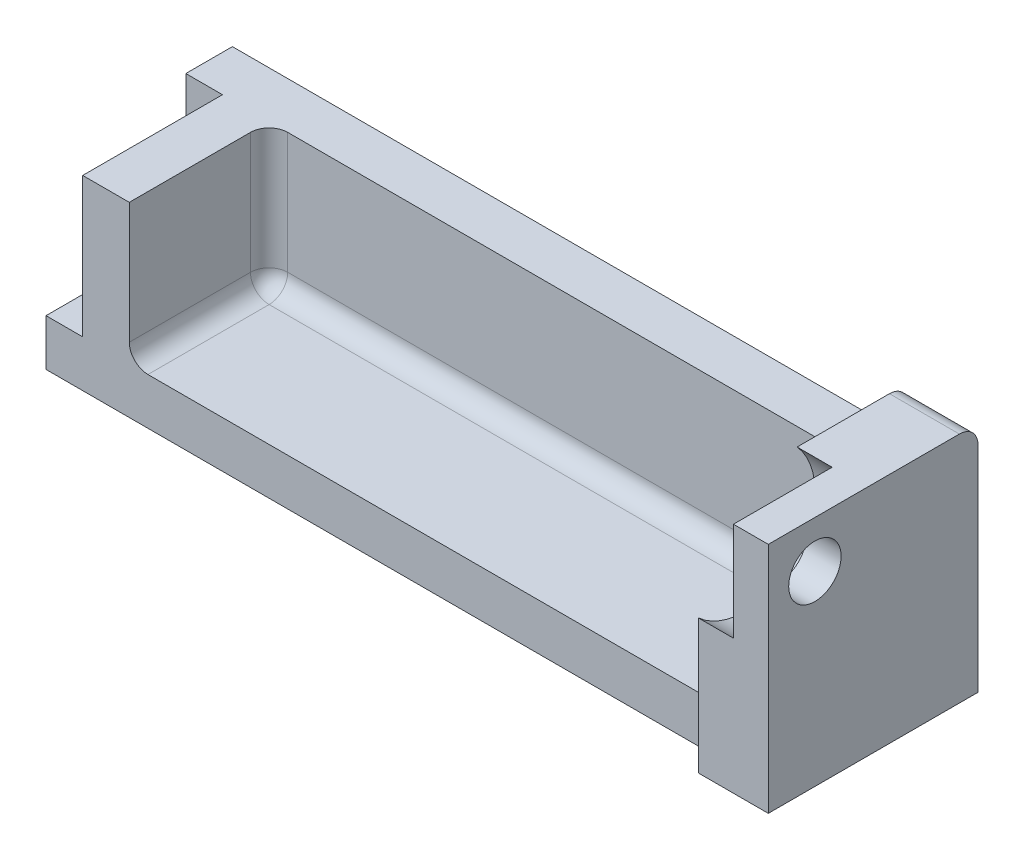
from build123d import *

# Parameters (mm, degrees)
SKETCH1_W                                = 101.6
SKETCH1_H                                = 25.4
BOSS_EXTRUDE1_DEPTH                      = 25.4
SKETCH2_W                                = 80.725
SKETCH2_H                                = 19.05
CUT_EXTRUDE1_DEPTH                       = 19.05
SKETCH3_W                                = 19.05
SKETCH3_H                                = 19.05
CUT_EXTRUDE2_DEPTH                       = 5
SKETCH4_W                                = 9.525
SKETCH4_H                                = 25.4
BOSS_EXTRUDE2_DEPTH                      = 3.175
SKETCH8_W                                = 9.525
SKETCH8_H                                = 28.575
BOSS_EXTRUDE3_DEPTH                      = 6.35
CBORE_FOR_1_4_HEX_HEAD_BOLT1_D           = 7.14248
CBORE_FOR_1_4_HEX_HEAD_BOLT1_DEPTH       = 9.906
CBORE_FOR_1_4_HEX_HEAD_BOLT1_CBORE_D     = 19.05
CBORE_FOR_1_4_HEX_HEAD_BOLT1_CBORE_DEPTH = 4.7752
CBORE_FOR_1_4_HEX_HEAD_BOLT1_TIP         = 2.145817477
FILLET1_R                                = 2.54


with BuildPart() as part:
    # Sketch1 → Boss-Extrude1 (new body)
    with BuildSketch(Plane.XY):
        with Locations((-16.075949367, 50.532067511)):
            Rectangle(SKETCH1_W, SKETCH1_H)
    extrude(amount=BOSS_EXTRUDE1_DEPTH)

    # Sketch2 → Cut-Extrude1 (cut)
    with BuildSketch(Plane(origin=(0, 63.232067511, 0), x_dir=(1, 0, 0), z_dir=(0, 1, 0))):
        with Locations((-15.163449367, -15.875)):
            Rectangle(SKETCH2_W, SKETCH2_H)
    extrude(amount=-CUT_EXTRUDE1_DEPTH, mode=Mode.SUBTRACT)

    # Sketch3 → Cut-Extrude2 (cut)
    with BuildSketch(Plane.ZY.offset(66.875949367)):
        with Locations((15.875, 53.707067511)):
            Rectangle(SKETCH3_W, SKETCH3_H)
    extrude(amount=-CUT_EXTRUDE2_DEPTH, mode=Mode.SUBTRACT)

    # Sketch4 → Boss-Extrude2 (add)
    with BuildSketch(Plane.XY.offset(25.4)):
        with Locations((29.961550633, 50.532067511)):
            Rectangle(SKETCH4_W, SKETCH4_H)
    extrude(amount=BOSS_EXTRUDE2_DEPTH)

    # Sketch8 → Boss-Extrude3 (add)
    with BuildSketch(Plane(origin=(0, 63.232067511, 0), x_dir=(1, 0, 0), z_dir=(0, 1, 0))):
        with Locations((29.961550633, -14.2875)):
            Rectangle(SKETCH8_W, SKETCH8_H)
    extrude(amount=BOSS_EXTRUDE3_DEPTH)

    # CBORE for 1/4 Hex Head Bolt1
    with Locations(Plane.ZY.offset(-25.199050633)):
        with Locations((22.225, 63.232067511)):
            CounterBoreHole(CBORE_FOR_1_4_HEX_HEAD_BOLT1_D / 2, CBORE_FOR_1_4_HEX_HEAD_BOLT1_CBORE_D / 2, CBORE_FOR_1_4_HEX_HEAD_BOLT1_CBORE_DEPTH, depth=CBORE_FOR_1_4_HEX_HEAD_BOLT1_DEPTH)
            with Locations((0, 0, -(CBORE_FOR_1_4_HEX_HEAD_BOLT1_DEPTH + CBORE_FOR_1_4_HEX_HEAD_BOLT1_TIP / 2))):  # 118° drill point
                Cone(0, CBORE_FOR_1_4_HEX_HEAD_BOLT1_D / 2, CBORE_FOR_1_4_HEX_HEAD_BOLT1_TIP, mode=Mode.SUBTRACT)

    # Fillet1
    fillet1_edges = [part.edges().sort_by_distance(p)[0] for p in [
        (-55.525949367, 44.182067511, 15.875),
        (-15.163449367, 44.182067511, 6.35),
        (-55.525949367, 53.707067511, 6.35),
        (25.199050633, 44.182067511, 15.875),
        (25.199050633, 53.707067511, 6.35),
        (25.199050633, 41.007067511, 25.4),
        (25.199050633, 63.232067511, 3.175),
        (29.961550633, 69.582067511, 0),
    ]]
    fillet(fillet1_edges, radius=FILLET1_R)


solid = part.part
